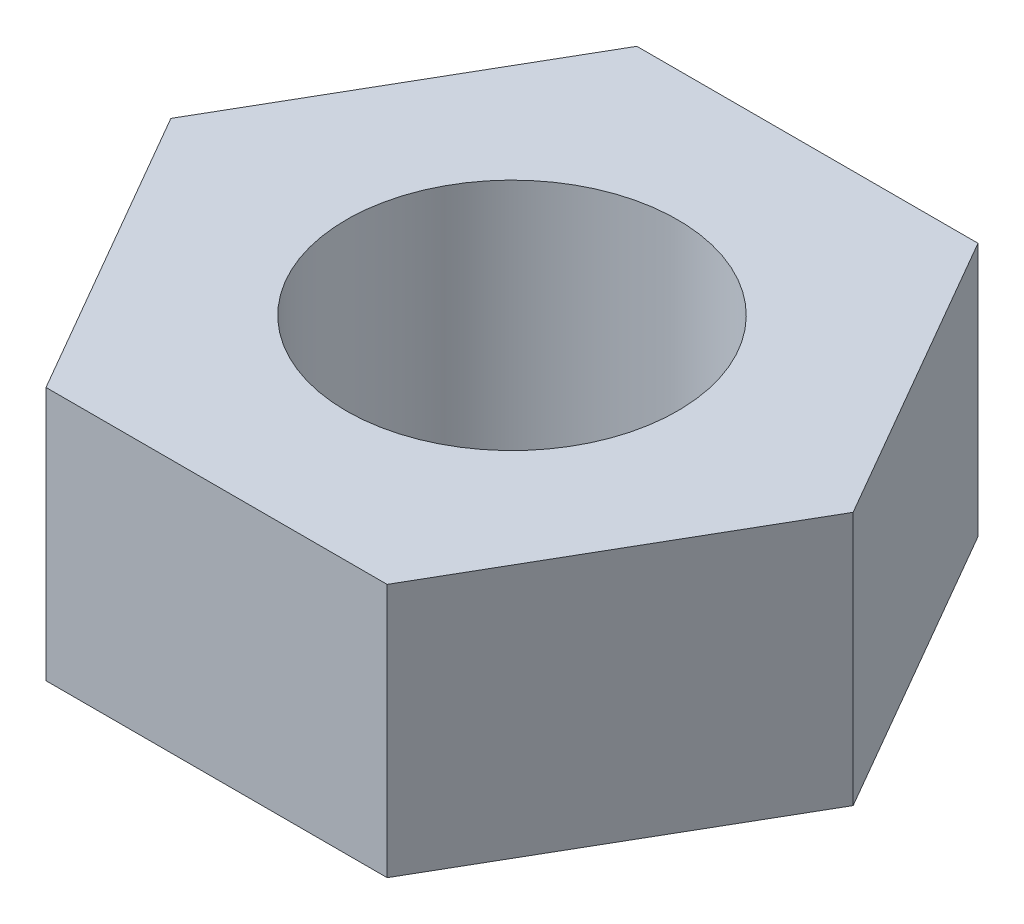
from build123d import *

# Parameters (mm, degrees)
BOSS_EXTRUDE1_DEPTH = 2.3
SKETCH2_R           = 1.5
CUT_EXTRUDE1_DEPTH  = 5.688971991


with BuildPart() as part:
    # Sketch1 → Boss-Extrude1 (new body)
    with BuildSketch(Plane(origin=(0, 0, 0), x_dir=(1, 0, 0), z_dir=(0, 1, 0))):
        Polygon((3.08882394, 0), (1.54441197, 2.675), (-1.54441197, 2.675), (-3.08882394, 0), (-1.54441197, -2.675), (1.54441197, -2.675), align=None)
    extrude(amount=BOSS_EXTRUDE1_DEPTH)

    # Sketch2 → Cut-Extrude1 (cut, through all)
    with BuildSketch(Plane(origin=(0, 2.3, 0), x_dir=(1, 0, 0), z_dir=(0, 1, 0))):
        with Locations(Location((0, 0, 0), (0, 0, 270))):
            Circle(SKETCH2_R)
    extrude(amount=-CUT_EXTRUDE1_DEPTH, mode=Mode.SUBTRACT)


solid = part.part
